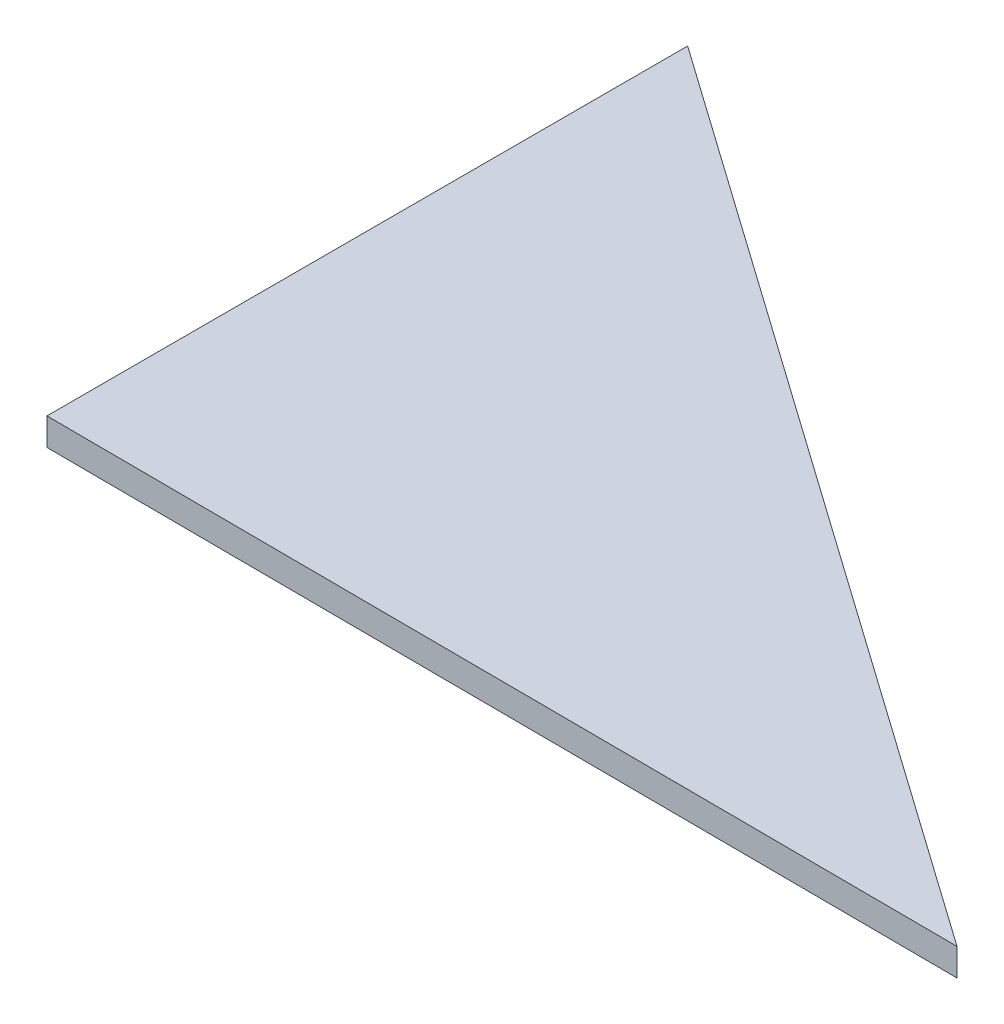
from build123d import *

# Parameters (mm, degrees)
SKETCH1_W           = 263.3434916
SKETCH1_H           = 204.19140391
BOSS_EXTRUDE1_DEPTH = 4.599999944
SKETCH2_OUTSIDE_W   = 331.995
SKETCH2_OUTSIDE_H   = 272.843
CUT_EXTRUDE1_DEPTH  = 334.264285513


with BuildPart() as part:
    # Sketch1 → Boss-Extrude1 (new body)
    with BuildSketch(Plane(origin=(0, 0, 0), x_dir=(1, 0, 0), z_dir=(0, 1, 0))):
        with Locations((131.6717458, 102.095701955)):
            Rectangle(SKETCH1_W, SKETCH1_H)
    extrude(amount=BOSS_EXTRUDE1_DEPTH)

    # Sketch2 outside → Cut-Extrude1 (cut, through all)
    with BuildSketch(Plane.XZ):
        with Locations((131.6715, -102.0955)):
            Rectangle(SKETCH2_OUTSIDE_W, SKETCH2_OUTSIDE_H)
        Polygon((0, -20.053354997), (0, -127.749354997), (153.715151128, -19.314530099), align=None, mode=Mode.SUBTRACT)
    extrude(amount=-CUT_EXTRUDE1_DEPTH, mode=Mode.SUBTRACT)


solid = part.part
